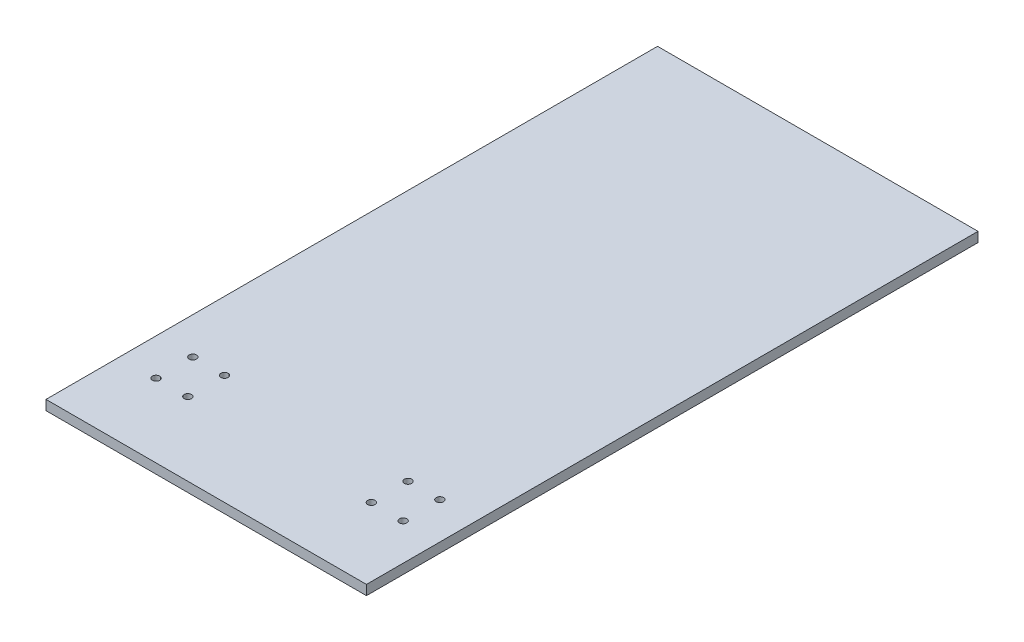
from build123d import *

# Parameters (mm, degrees)
SKETCH1_W           = 131
SKETCH1_H           = 250
SKETCH1_R           = 1.5
BOSS_EXTRUDE1_DEPTH = 4


with BuildPart() as part:
    # Sketch1 → Boss-Extrude1 (new body)
    with BuildSketch(Plane(origin=(0, 0, 0), x_dir=(1, 0, 0), z_dir=(0, 1, 0))):
        Rectangle(SKETCH1_W, SKETCH1_H)
        with Locations(Location((-50.5, -80, 0), (0, 0, 270))):
            Circle(SKETCH1_R, mode=Mode.SUBTRACT)
        with Locations(Location((-37.5, -80, 0), (0, 0, 270))):
            Circle(SKETCH1_R, mode=Mode.SUBTRACT)
        with Locations(Location((-37.5, -95, 0), (0, 0, 270))):
            Circle(SKETCH1_R, mode=Mode.SUBTRACT)
        with Locations(Location((-50.5, -95, 0), (0, 0, 270))):
            Circle(SKETCH1_R, mode=Mode.SUBTRACT)
        with Locations(Location((50.5, -95, 0), (0, 0, 90))):
            Circle(SKETCH1_R, mode=Mode.SUBTRACT)
        with Locations(Location((37.5, -95, 0), (0, 0, 90))):
            Circle(SKETCH1_R, mode=Mode.SUBTRACT)
        with Locations(Location((37.5, -80, 0), (0, 0, 90))):
            Circle(SKETCH1_R, mode=Mode.SUBTRACT)
        with Locations(Location((50.5, -80, 0), (0, 0, 90))):
            Circle(SKETCH1_R, mode=Mode.SUBTRACT)
    extrude(amount=BOSS_EXTRUDE1_DEPTH)


solid = part.part
